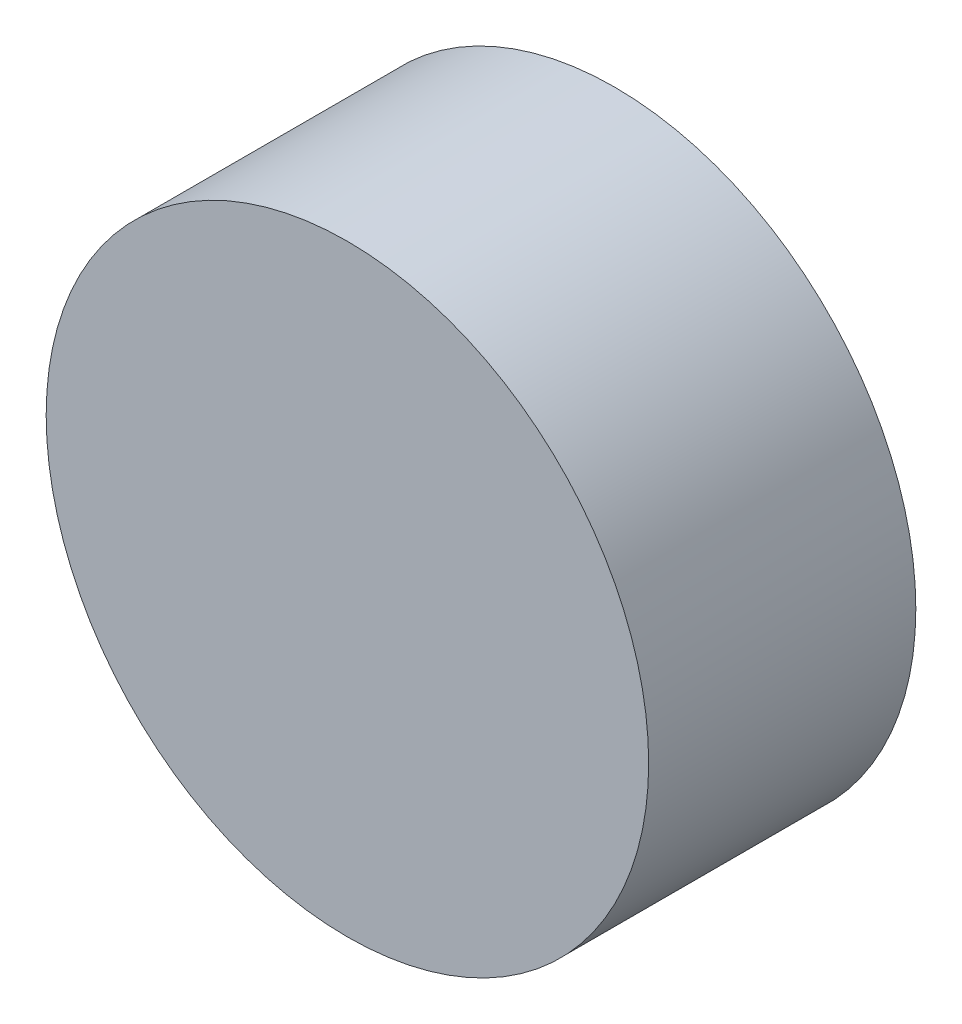
from build123d import *

# Parameters (mm, degrees)
SKETCH_1_R      = 21.425129657
EXTRUDE_1_DEPTH = 19


with BuildPart() as part:
    # 草图1 → 凸台-拉伸1 (new body)
    with BuildSketch(Plane.XY):
        Circle(SKETCH_1_R)
    extrude(amount=EXTRUDE_1_DEPTH)


solid = part.part
